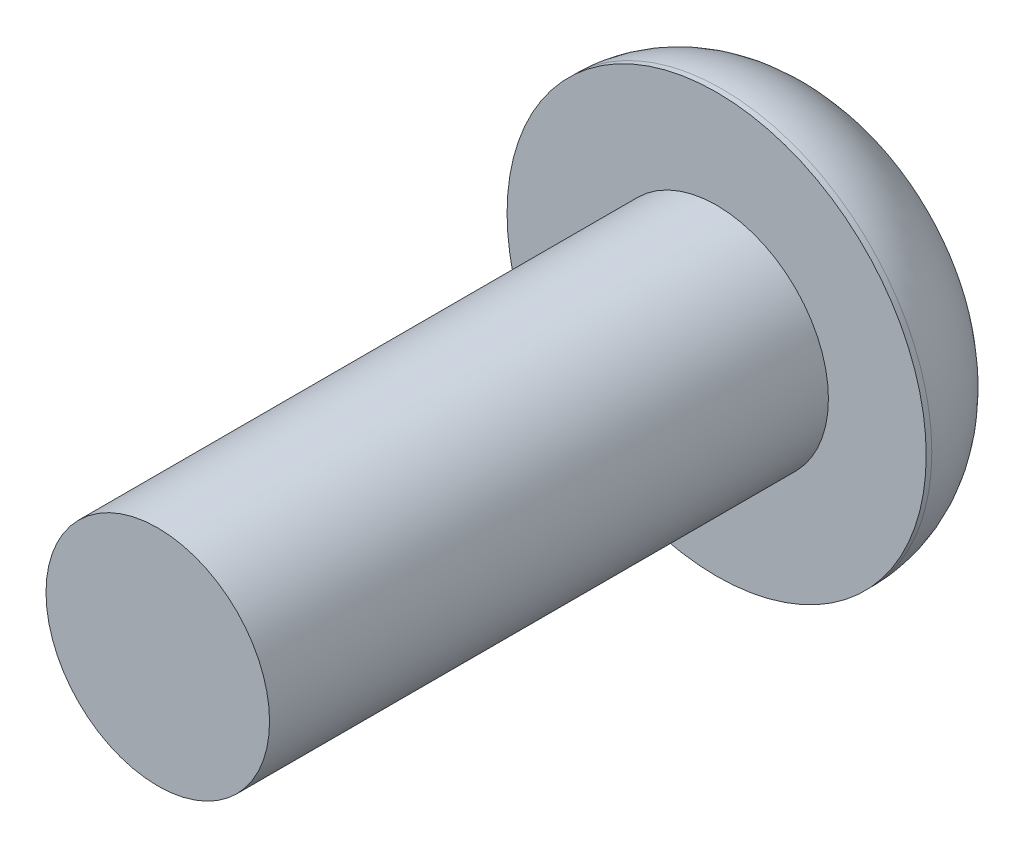
from build123d import *

# Parameters (mm, degrees)
SKETCH_1_R      = 2
EXTRUDE_1_DEPTH = 10
SKETCH_2_R      = 3.75
EXTRUDE_2_DEPTH = 2.1
FILLET_1_R      = 2


with BuildPart() as part:
    # 草图1 → 凸台-拉伸1 (new body)
    with BuildSketch(Plane.XY):
        Circle(SKETCH_1_R)
    extrude(amount=EXTRUDE_1_DEPTH)

    # 草图2 → 凸台-拉伸2 (add)
    with BuildSketch(Plane(origin=(0, 0, 0), x_dir=(-1, 0, 0), z_dir=(0, 0, -1))):
        Circle(SKETCH_2_R)
    extrude(amount=EXTRUDE_2_DEPTH)

    # 圆角1
    fillet_1_edges = [part.edges().sort_by_distance(p)[0] for p in [
        (3.75, 0, -2.1),
    ]]
    fillet(fillet_1_edges, radius=FILLET_1_R)


solid = part.part
